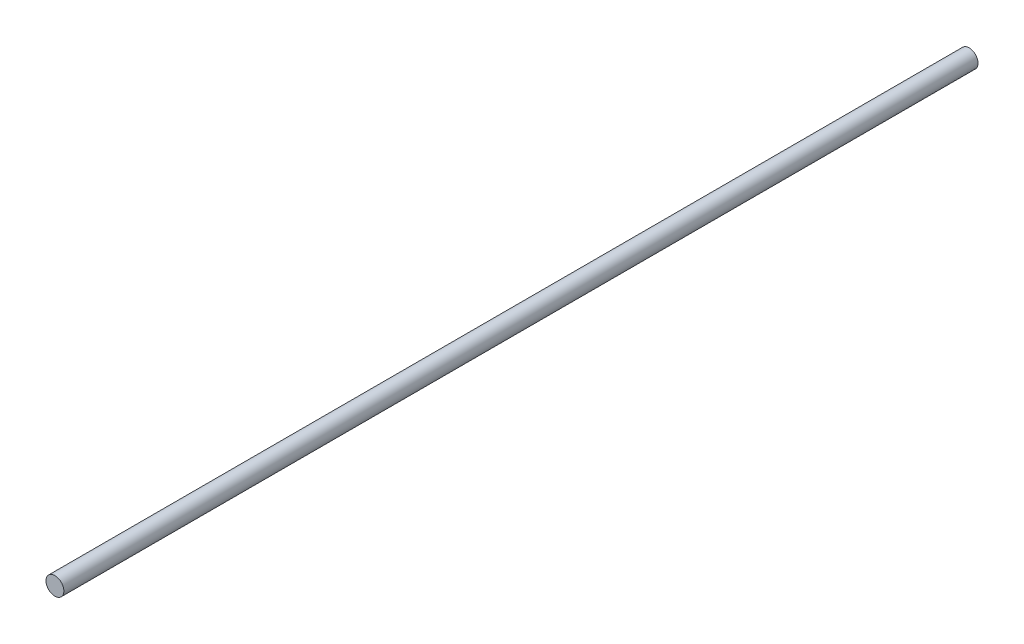
from build123d import *

# Parameters (mm, degrees)
SKETCH1_R           = 5
BOSS_EXTRUDE1_DEPTH = 512


with BuildPart() as part:
    # Sketch1 → Boss-Extrude1 (new body)
    with BuildSketch(Plane.XY):
        Circle(SKETCH1_R)
    extrude(amount=BOSS_EXTRUDE1_DEPTH)


solid = part.part
